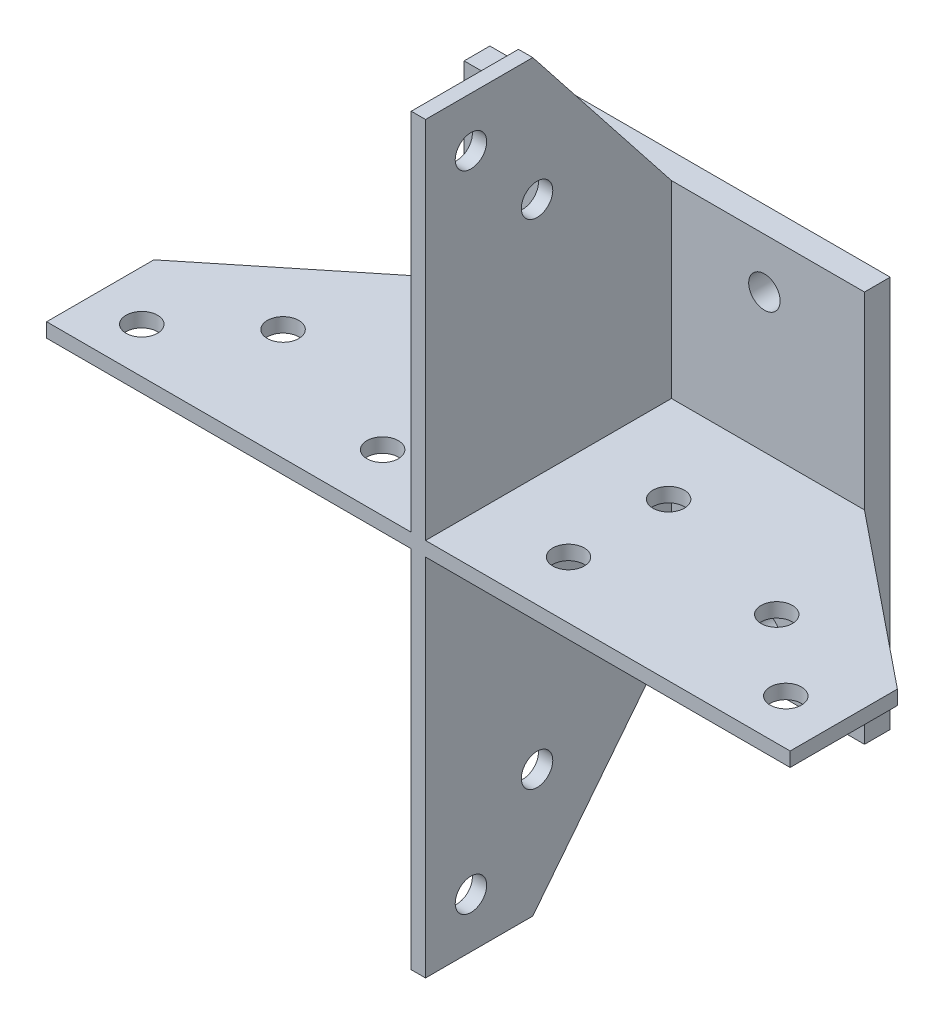
from build123d import *

# Parameters (mm, degrees)
SKETCH_1_W                  = 280
SKETCH_1_H                  = 274
EXTRUDE_1_DEPTH             = 18
SKETCH_2_W                  = 520
SKETCH_2_H                  = 10
EXTRUDE_2_DEPTH             = 172
SKETCH_3_W                  = 10
SKETCH_3_H                  = 520
EXTRUDE_3_DEPTH             = 172
CUT_EXTRUDE_1_DEPTH         = 514.745072969
CUT_EXTRUDE_2_DEPTH         = 514.745072969
CUT_EXTRUDE_3_DEPTH         = 517.066856134
CUT_EXTRUDE_4_DEPTH         = 517.066856134
SKETCH_9_R                  = 11.000000001
SKETCH_9_R_2                = 11
CUT_EXTRUDE_5_DEPTH         = 517.066856134
SKETCH_10_R                 = 11
CUT_EXTRUDE_6_DEPTH         = 514.745072969
SKETCH_11_R                 = 11
CUT_EXTRUDE_7_DEPTH         = 595.734394499
PATTERN_LINEAR_1_COUNT      = 2
PATTERN_LINEAR_1_PITCH      = 140
PATTERN_LINEAR_1_COUNT_DIR2 = 2
PATTERN_LINEAR_1_PITCH_DIR2 = 204


with BuildPart() as part:
    # 草图1 → 拉伸1 (new body)
    with BuildSketch(Plane.XY):
        with Locations((140, 137)):
            Rectangle(SKETCH_1_W, SKETCH_1_H)
    extrude(amount=EXTRUDE_1_DEPTH)

    # 草图2 → 拉伸2 (add)
    with BuildSketch(Plane.XY.offset(18)):
        with Locations((140, 137)):
            Rectangle(SKETCH_2_W, SKETCH_2_H)
    extrude(amount=EXTRUDE_2_DEPTH)

    # 草图3 → 拉伸3 (add)
    with BuildSketch(Plane.XY.offset(18)):
        with Locations((140, 137)):
            Rectangle(SKETCH_3_W, SKETCH_3_H)
    extrude(amount=EXTRUDE_3_DEPTH)

    # 草图4 → 切除-拉伸1 (cut, through all)
    with BuildSketch(Plane(origin=(145, 0, 0), x_dir=(0, 0, -1), z_dir=(1, 0, 0))):
        Polygon((-115, 397), (-18, 274), (-18, 397), align=None)
    extrude(amount=-CUT_EXTRUDE_1_DEPTH, mode=Mode.SUBTRACT)

    # 草图5 → 切除-拉伸2 (cut, through all)
    with BuildSketch(Plane.ZY.offset(-135)):
        Polygon((115, -123), (18, 0), (18, -123), align=None)
    extrude(amount=-CUT_EXTRUDE_2_DEPTH, mode=Mode.SUBTRACT)

    # 草图6 → 切除-拉伸3 (cut, through all)
    with BuildSketch(Plane(origin=(0, 142, 0), x_dir=(1, 0, 0), z_dir=(0, 1, 0))):
        Polygon((280, -18), (400, -115), (400, -18), align=None)
    extrude(amount=-CUT_EXTRUDE_3_DEPTH, mode=Mode.SUBTRACT)

    # 草图8 → 切除-拉伸4 (cut, through all)
    with BuildSketch(Plane(origin=(0, 142, 0), x_dir=(1, 0, 0), z_dir=(0, 1, 0))):
        Polygon((0, -18), (-120, -115), (-120, -18), align=None)
    extrude(amount=-CUT_EXTRUDE_4_DEPTH, mode=Mode.SUBTRACT)

    # 草图9 → 切除-拉伸5 (cut, through all)
    with BuildSketch(Plane.XZ.offset(-132)):
        with Locations(Location((-85.189055636, 158.240447361, 0), (0, 0, 270))):
            Circle(SKETCH_9_R)
        with Locations(Location((75, 150, 0), (0, 0, 270))):
            Circle(SKETCH_9_R_2)
        with Locations(Location((-32.636595866, 112, 0), (0, 0, 270))):
            Circle(SKETCH_9_R_2)
        with Locations(Location((75, 80, 0), (0, 0, 270))):
            Circle(SKETCH_9_R_2)
        with Locations(Location((205, 150, 0), (0, 0, 270))):
            Circle(SKETCH_9_R_2)
        with Locations(Location((205, 80, 0), (0, 0, 270))):
            Circle(SKETCH_9_R_2)
        with Locations(Location((365.189055636, 158.240447361, 0), (0, 0, 270))):
            Circle(SKETCH_9_R)
        with Locations(Location((312.636595866, 112, 0), (0, 0, 270))):
            Circle(SKETCH_9_R_2)
    extrude(amount=-CUT_EXTRUDE_5_DEPTH, mode=Mode.SUBTRACT)

    # 草图10 → 切除-拉伸6 (cut, through all)
    with BuildSketch(Plane(origin=(145, 0, 0), x_dir=(0, 0, -1), z_dir=(1, 0, 0))):
        with Locations(Location((-158.241096139, 362.189055636, 0), (0, 0, 90))):
            Circle(SKETCH_10_R)
        with Locations(Location((-112, 309.636595866, 0), (0, 0, 90))):
            Circle(SKETCH_10_R)
        with Locations(Location((-112, -35.636595866, 0), (0, 0, 90))):
            Circle(SKETCH_10_R)
        with Locations(Location((-158.241096139, -88.189055636, 0), (0, 0, 90))):
            Circle(SKETCH_10_R)
    extrude(amount=-CUT_EXTRUDE_6_DEPTH, mode=Mode.SUBTRACT)

    # 草图11 → 切除-拉伸7 (cut, through all)
    with BuildSketch(Plane(origin=(0, 0, 0), x_dir=(-1, 0, 0), z_dir=(0, 0, -1))):
        with Locations((-210, 35)):
            Circle(SKETCH_11_R)
    cut_extrude_7 = extrude(amount=-CUT_EXTRUDE_7_DEPTH, mode=Mode.SUBTRACT)

    # 阵列(线性)1: Cut-Extrude 7 2 × 2
    with Locations(*[(-i * PATTERN_LINEAR_1_PITCH, j * PATTERN_LINEAR_1_PITCH_DIR2, 0) for i in range(PATTERN_LINEAR_1_COUNT) for j in range(PATTERN_LINEAR_1_COUNT_DIR2) if (i, j) != (0, 0)]):
        add(cut_extrude_7, mode=Mode.SUBTRACT)


solid = part.part
